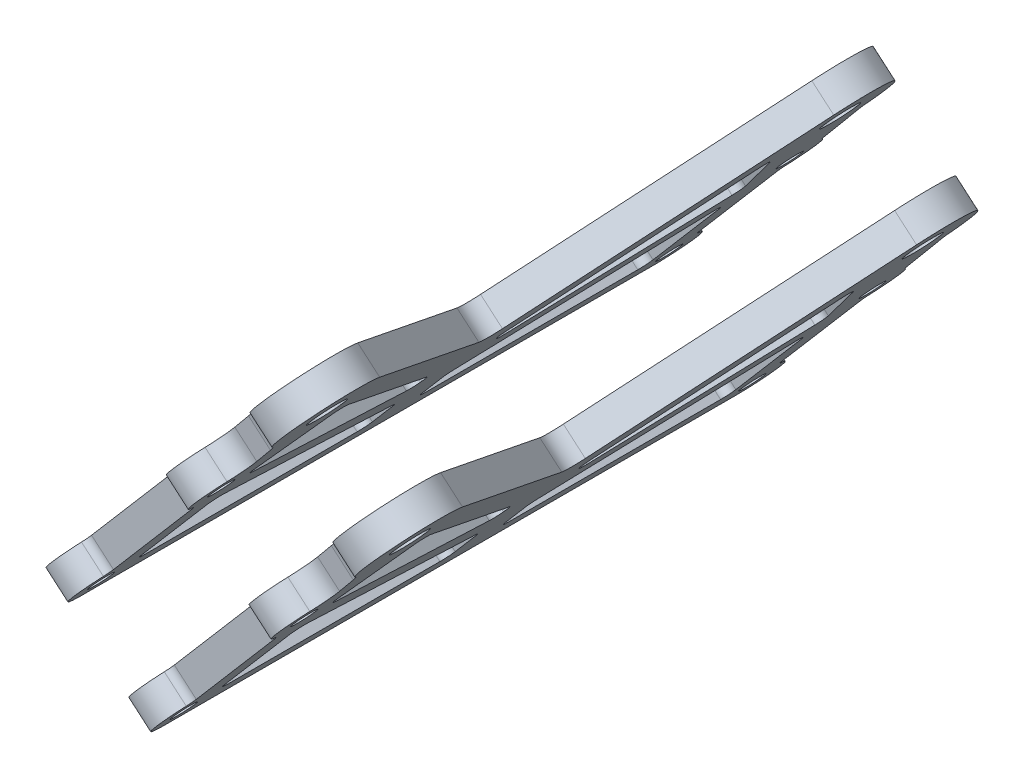
from build123d import *

# Parameters (mm, degrees)
BOSS_EXTRUDE1_DEPTH      = 18.9611
BOSS_EXTRUDE1_DEPTH_BACK = 18.9611
SKETCH1_R                = 4.7625
SKETCH1_R_2              = 3.175
CUT_EXTRUDE1_DEPTH       = 1912.028973841
CUT_EXTRUDE2_DEPTH       = 2050.106947354
CUT_EXTRUDE3_DEPTH       = 1901.723151815
CUT_EXTRUDE3_DEPTH_BACK  = 1901.723151815
SKETCH7_R                = 3.175
BOSS_EXTRUDE2_DEPTH      = 7.9375
SKETCH8_R                = 3.175
BOSS_EXTRUDE3_DEPTH      = 7.9375


with BuildPart() as part:
    # Sketch1 → Boss-Extrude1 (new, two sides: drawn at the far end of the back side and taken through both)
    with BuildSketch(Plane(origin=(982.319967542, -841.777618674, 0), x_dir=(-0.6448889446059889, -0.7525589574729126, -0.13331640803838368), z_dir=(-0.7593371603520005, 0.6506973773641327, 0)).offset(-BOSS_EXTRUDE1_DEPTH_BACK)):
        Polygon((-1825.093504059, 107.236165962), (-1849.376453974, 125.810481218), (-1868.170139552, 265.522106656), (-1849.65116336, 289.797685347), (-1748.958099981, 303.342683961), (-1724.400433745, 120.781113019), align=None)
        with Locations(Location((-1846.77286211, 268.400407905, 0), (0, 0, 7.661277177))):
            Circle(SKETCH1_R, mode=Mode.SUBTRACT)
        with Locations(Location((-1827.971805309, 128.633443404, 0), (0, 0, 7.661277177))):
            Circle(SKETCH1_R, mode=Mode.SUBTRACT)
        with Locations(Location((-1764.716955852, 287.127012036, 0), (0, 0, 7.661277177))):
            Circle(SKETCH1_R_2, mode=Mode.SUBTRACT)
        with Locations(Location((-1815.063491009, 280.354538507, 0), (0, 0, 7.661277177))):
            Circle(SKETCH1_R_2, mode=Mode.SUBTRACT)
        with Locations(Location((-1743.884145549, 132.256001917, 0), (0, 0, 187.661277177))):
            Circle(SKETCH1_R_2, mode=Mode.SUBTRACT)
        with Locations(Location((-1794.230680706, 125.483528389, 0), (0, 0, 187.661277177))):
            Circle(SKETCH1_R_2, mode=Mode.SUBTRACT)
        with Locations(Location((-1779.473818279, 206.305270212, 0), (0, 0, 7.661277177))):
            Circle(SKETCH1_R_2, mode=Mode.SUBTRACT)
    extrude(amount=BOSS_EXTRUDE1_DEPTH + BOSS_EXTRUDE1_DEPTH_BACK)

    # Sketch4 → Cut-Extrude1 (cut, through all)
    # profile 1 of 3: a face of its own
    with BuildSketch(Plane(origin=(967.922099711, -829.439680632, 0), x_dir=(0, 0, 1), z_dir=(-0.7593371603519986, 0.6506973773641347, 0))):
        Polygon((533.799715295, 1692.905515188), (533.799663273, 1794.505515188), (512.209663273, 1816.095515188), (371.239663273, 1816.095443008), (349.593835486, 1794.505515188), (349.593835486, 1692.905515188), align=None)
        with BuildLine():
            ThreePointArc((523.501560226, 1754.808548216), (522.539140557, 1753.875711878), (522.185511571, 1752.582892559))
            Line((522.185511571, 1752.582892559), (522.185511571, 1719.588137817))
            ThreePointArc((522.185511571, 1719.588137817), (522.539140557, 1718.295318498), (523.501560226, 1717.36248216))
            ThreePointArc((523.501560226, 1717.36248216), (527.210183422, 1708.790005801), (519.829706191, 1703.065515188))
            Line((519.829706191, 1703.065515188), (363.563792568, 1703.065515188))
            ThreePointArc((363.563792568, 1703.065515188), (356.183315337, 1708.790005801), (359.891938533, 1717.36248216))
            ThreePointArc((359.891938533, 1717.36248216), (360.854358202, 1718.295318498), (361.207987188, 1719.588137817))
            Line((361.207987188, 1719.588137817), (361.207987188, 1752.582892559))
            ThreePointArc((361.207987188, 1752.582892559), (360.854358202, 1753.875711878), (359.891938533, 1754.808548216))
            ThreePointArc((359.891938533, 1754.808548216), (356.03178509, 1760.330844956), (358.060388323, 1766.755898638))
            ThreePointArc((358.060388323, 1766.755898638), (358.535275015, 1767.455110725), (358.754436385, 1768.271433704))
            Line((358.754436385, 1768.271433704), (360.50842891, 1786.654129308))
            ThreePointArc((360.50842891, 1786.654129308), (360.462048044, 1787.434466143), (360.180566553, 1788.163743135))
            ThreePointArc((360.180566553, 1788.163743135), (362.993688723, 1804.211775847), (379.286252353, 1804.285128725))
            Line((379.286252353, 1804.285128725), (438.455782633, 1755.263130226))
            ThreePointArc((438.455782633, 1755.263130226), (441.69674938, 1754.094975641), (444.937716126, 1755.263130226))
            Line((444.937716126, 1755.263130226), (504.107246406, 1804.285128725))
            ThreePointArc((504.107246406, 1804.285128725), (521.395356495, 1803.275523171), (521.603848998, 1785.959213382))
            ThreePointArc((521.603848998, 1785.959213382), (520.550545254, 1784.379654664), (520.011273205, 1782.559313987))
            Line((520.011273205, 1782.559313987), (518.992404756, 1775.220826861))
            ThreePointArc((518.992404756, 1775.220826861), (519.758674906, 1771.214754109), (522.803724675, 1768.501184369))
            ThreePointArc((522.803724675, 1768.501184369), (527.439829487, 1761.873359758), (523.501560226, 1754.808548216))
        make_face(mode=Mode.SUBTRACT)
    # profile 2 of 3: a face of its own
    with BuildSketch(Plane(origin=(967.922099711, -829.439680632, 0), x_dir=(0, 0, 1), z_dir=(-0.7593371603519986, 0.6506973773641347, 0))):
        with BuildLine():
            Line((503.58625562, 1782.846492637), (510.633989568, 1761.166953574))
            ThreePointArc((510.633989568, 1761.166953574), (510.481755663, 1759.228891496), (509.003693199, 1757.966120284))
            Line((509.003693199, 1757.966120284), (455.262530042, 1740.495572645))
            ThreePointArc((455.262530042, 1740.495572645), (453.493004886, 1740.569591242), (452.202014673, 1741.782044252))
            Line((452.202014673, 1741.782044252), (452.0386495, 1742.111243025))
            ThreePointArc((452.0386495, 1742.111243025), (451.829241618, 1743.767679183), (452.693413036, 1745.196258956))
            Line((452.693413036, 1745.196258956), (499.550207417, 1784.017146884))
            ThreePointArc((499.550207417, 1784.017146884), (501.878254549, 1784.500681807), (503.58625562, 1782.846492637))
        make_face()
    # profile 3 of 3: a face of its own
    with BuildSketch(Plane(origin=(967.922099711, -829.439680632, 0), x_dir=(0, 0, 1), z_dir=(-0.7593371603519986, 0.6506973773641347, 0))):
        with BuildLine():
            ThreePointArc((381.763165846, 1781.226009264), (383.471166918, 1782.880198433), (385.799214049, 1782.396663511))
            Line((385.799214049, 1782.396663511), (430.863642877, 1745.060751736))
            ThreePointArc((430.863642877, 1745.060751736), (431.772060495, 1743.342020457), (431.199082211, 1741.484345656))
            Line((431.199082211, 1741.484345656), (431.003290571, 1741.248025234))
            ThreePointArc((431.003290571, 1741.248025234), (429.754931622, 1740.429050977), (428.262099404, 1740.452943778))
            Line((428.262099404, 1740.452943778), (376.635226723, 1757.2361633))
            ThreePointArc((376.635226723, 1757.2361633), (375.157164258, 1758.498934511), (375.004930353, 1760.43699659))
            Line((375.004930353, 1760.43699659), (381.763165846, 1781.226009264))
        make_face()
    extrude(amount=-CUT_EXTRUDE1_DEPTH, mode=Mode.SUBTRACT)

    # Sketch5 → Cut-Extrude2 (cut, through all)
    with BuildSketch(Plane(origin=(585.134447705, 682.827909564, -745.022692064), x_dir=(-0.8654076743040418, 0.33855475054756057, -0.36939171368257406), z_dir=(0.5010684157434688, 0.5847262970291663, -0.637985580014854))):
        Polygon((-1891.484017469, 739.988732458), (-1872.139078963, 750.564761111), (-1775.958603687, 574.638102737), (-1795.303542193, 564.062074084), align=None)
    extrude(amount=-CUT_EXTRUDE2_DEPTH, mode=Mode.SUBTRACT)


with BuildPart() as cut_extrude2_piece_1:
    # of the separate pieces the step leaves, piece 1, a body of its own (cut_extrude2_pieces)
    add(part.part.solids().sort_by_distance((2118.681182245, 513.448986786, 522.803724675))[0])


with BuildPart() as cut_extrude2_piece_2:
    # of the separate pieces the step leaves, piece 2, a body of its own (cut_extrude2_pieces)
    add(part.part.solids().sort_by_distance((2132.539916763, 483.54069368, 523.501560226))[0])


with BuildPart() as cut_extrude3_tool:
    # Sketch6 → Cut-Extrude3 (new, two sides: drawn at the far end of the back side and taken through both)
    with BuildSketch(Plane(origin=(967.922099711, -829.439680632, 0), x_dir=(0, 0, 1), z_dir=(-0.7593371603519986, 0.6506973773641347, 0)).offset(-CUT_EXTRUDE3_DEPTH_BACK)):
        with BuildLine():
            Line((371.367987188, 1743.433103907), (371.367987188, 1715.765515188))
            ThreePointArc((371.367987188, 1715.765515188), (372.111935964, 1713.969463964), (373.907987188, 1713.225515188))
            Line((373.907987188, 1713.225515188), (432.327987188, 1713.225515188))
            ThreePointArc((432.327987188, 1713.225515188), (434.124038413, 1713.969463964), (434.867987188, 1715.765515188))
            Line((434.867987188, 1715.765515188), (434.867987188, 1724.441527745))
            ThreePointArc((434.867987188, 1724.441527745), (434.383003233, 1725.934346909), (433.113255648, 1726.857092575))
            Line((433.113255648, 1726.857092575), (374.693255648, 1745.848668736))
            ThreePointArc((374.693255648, 1745.848668736), (372.415168025, 1745.488119951), (371.367987188, 1743.433103907))
        make_face()
        with BuildLine():
            Line((448.525511571, 1724.441527745), (448.525511571, 1715.765515188))
            ThreePointArc((448.525511571, 1715.765515188), (449.269460346, 1713.969463964), (451.065511571, 1713.225515188))
            Line((451.065511571, 1713.225515188), (509.485511571, 1713.225515188))
            ThreePointArc((509.485511571, 1713.225515188), (511.281562795, 1713.969463964), (512.025511571, 1715.765515188))
            Line((512.025511571, 1715.765515188), (512.025511571, 1743.433103907))
            ThreePointArc((512.025511571, 1743.433103907), (510.978330734, 1745.488119951), (508.700243111, 1745.848668736))
            Line((508.700243111, 1745.848668736), (450.280243111, 1726.857092575))
            ThreePointArc((450.280243111, 1726.857092575), (449.010495526, 1725.934346909), (448.525511571, 1724.441527745))
        make_face()
    extrude(amount=CUT_EXTRUDE3_DEPTH + CUT_EXTRUDE3_DEPTH_BACK)


with BuildPart() as cut_extrude2_piece_1_1:
    add(cut_extrude2_piece_1.part)

    # Cut-Extrude3: cut by cut_extrude3_tool
    add(cut_extrude3_tool.part, mode=Mode.SUBTRACT)

    # Sketch7 → Boss-Extrude2 (add)
    with BuildSketch(Plane(origin=(967.922099711, -829.439680632, 0), x_dir=(0, 0, 1), z_dir=(-0.7593371603519986, 0.6506973773641347, 0))):
        with Locations(Location((441.69674938, 1736.085515188, 0), (0, 0, 270))):
            Circle(SKETCH7_R)
    extrude(amount=-BOSS_EXTRUDE2_DEPTH)


with BuildPart() as cut_extrude2_piece_2_1:
    add(cut_extrude2_piece_2.part)

    # Cut-Extrude3: cut by cut_extrude3_tool
    add(cut_extrude3_tool.part, mode=Mode.SUBTRACT)

    # Sketch8 → Boss-Extrude3 (add)
    with BuildSketch(Plane(origin=(996.717835373, -854.115556716, 0), x_dir=(0, 0, -1), z_dir=(0.7593371603519986, -0.6506973773641347, 0))):
        with Locations((-441.69674938, 1736.085515188)):
            Circle(SKETCH8_R)
    extrude(amount=-BOSS_EXTRUDE3_DEPTH)


solid = Compound([cut_extrude2_piece_1_1.part, cut_extrude2_piece_2_1.part])
